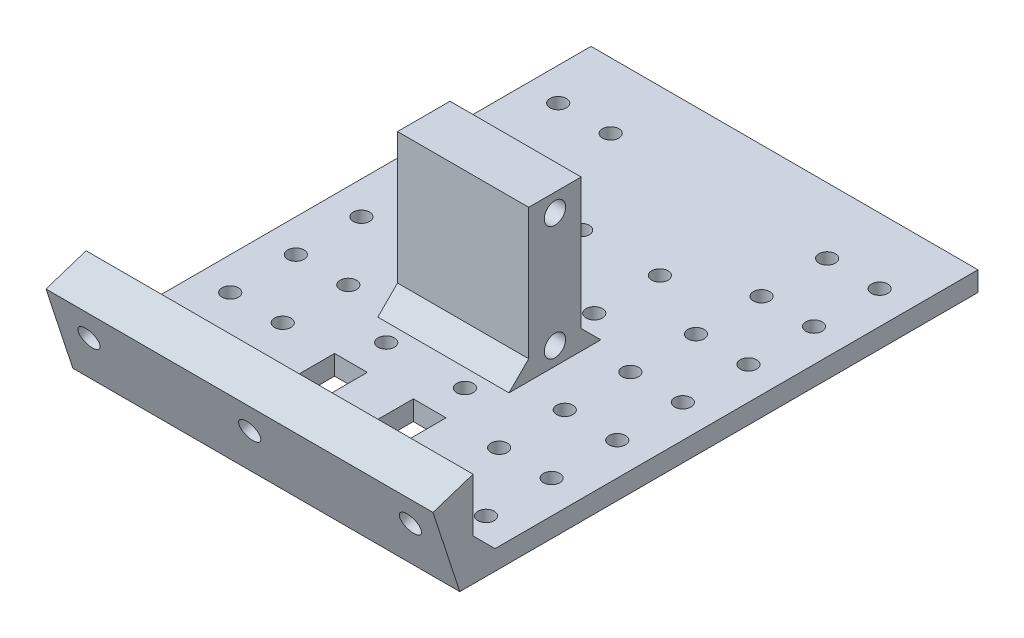
from build123d import *

# Parameters (mm, degrees)
SALIENTE_EXTRUIR1_DEPTH = 3
SKETCH1_W               = 20
SKETCH1_H               = 7
SKETCH1_H_2             = 8
SKETCH1_W_2             = 7
SKETCH1_H_3             = 38.5
BOSS_EXTRUDE1_DEPTH     = 23
CUT_EXTRUDE1_DEPTH      = 85.65548432
SKETCH3_R               = 1.625
CUT_EXTRUDE2_DEPTH      = 73.427902257
CORTAR_EXTRUIR1_DEPTH   = 10
CORTAR_EXTRUIR2_REACH   = 71.098
CROQUIS4_R              = 1.25
CORTAR_EXTRUIR3_DEPTH   = 3
BOSS_EXTRUDE2_DEPTH     = 20
SALIENTE_EXTRUIR2_DEPTH = 59
CORTAR_EXTRUIR4_REACH   = 91.44
CROQUIS7_R              = 1.625
CORTAR_EXTRUIR5_START   = -2.42548
CORTAR_EXTRUIR5_DEPTH   = 4
SALIENTE_EXTRUIR4_START = -20
SALIENTE_EXTRUIR4_DEPTH = 20
CROQUIS17_W             = 7
CROQUIS17_H             = 23
CORTAR_EXTRUIR11_DEPTH  = 73.427902257
CUT_EXTRUDE3_DEPTH      = 85.65548432
LOCAL_FILES2_R          = 1.625
CUT_EXTRUDE4_DEPTH      = 10
CUT_EXTRUDE5_START      = -2.42548
CUT_EXTRUDE5_DEPTH      = 4


with BuildPart() as part:
    # Croquis1 → Saliente-Extruir1 (new body)
    with BuildSketch(Plane(origin=(0, 0, 0), x_dir=(1, 0, 0), z_dir=(0, 1, 0))):
        Polygon((-29.5, 32.640625), (29.5, 32.640625), (29.5, -47.359375), (8.5, -47.359375), (8.5, -27.453125), (3.5, -27.453125), (3.5, -47.359375), (-3.5, -47.359375), (-3.5, -27.453125), (-8.5, -27.453125), (-8.5, -47.359375), (-29.5, -47.359375), align=None)
    extrude(amount=SALIENTE_EXTRUIR1_DEPTH)

    # Sketch1 → Boss-Extrude1 (add)
    with BuildSketch(Plane(origin=(0, 3, 0), x_dir=(1, 0, 0), z_dir=(0, 1, 0))):
        with Locations((0, 19.640625)):
            Rectangle(SKETCH1_W, SKETCH1_H)
        with Locations((0, -12.359375)):
            Rectangle(SKETCH1_W, SKETCH1_H_2)
        with Locations((0, -35.609375)):
            Rectangle(SKETCH1_W_2, SKETCH1_H_3)
    extrude(amount=BOSS_EXTRUDE1_DEPTH)

    # Sketch2 → Cut-Extrude1 (cut, through all)
    with BuildSketch(Plane(origin=(29.5, 0, 0), x_dir=(0, 0, -1), z_dir=(1, 0, 0))):
        Polygon((-54.859375, 26), (-46.359375, 0), (-47.359375, 0), (-47.359375, 3), (-54.859375, 3), align=None)
    extrude(amount=-CUT_EXTRUDE1_DEPTH, mode=Mode.SUBTRACT)

    # Sketch3 → Cut-Extrude2 (cut, through all)
    with BuildSketch(Plane.ZY.offset(10)):
        with Locations((12.359375, 5.75)):
            Circle(SKETCH3_R)
        with Locations((12.359375, 23.25)):
            Circle(SKETCH3_R)
    extrude(amount=-CUT_EXTRUDE2_DEPTH, mode=Mode.SUBTRACT)

    # Croquis2 → Cortar-Extruir1 (cut)
    with BuildSketch(Plane(origin=(0, 0, -23.140625), x_dir=(-1, 0, 0), z_dir=(0, 0, -1))):
        Polygon((-5, 6), (-5, 3), (5, 3), (5, 6), (5, 21), (-5, 21), align=None)
    extrude(amount=-CORTAR_EXTRUIR1_DEPTH, mode=Mode.SUBTRACT)

    # Croquis3 → Cortar-Extruir2 (cut, up to next)
    with BuildSketch(Plane.ZY.offset(3.5), mode=Mode.PRIVATE) as cortar_extruir2_sk1:
        Polygon((21.90625, 3), (36.90625, 3), (36.90625, 26), (21.90625, 26), (16.359375, 26), (16.359375, 3), align=None)
    cortar_extruir2_tool1 = extrude(cortar_extruir2_sk1.sketch, amount=-CORTAR_EXTRUIR2_REACH, mode=Mode.PRIVATE) & part.part
    add(cortar_extruir2_tool1.solids().sort_by_distance((-3.5, 14.5, 26.632812))[0], mode=Mode.SUBTRACT)

    # Croquis4 → Cortar-Extruir3 (cut)
    with BuildSketch(Plane.XZ):
        with Locations(Location((-24.5, -22.640625, 0), (0, 0, 270))):
            Circle(CROQUIS4_R)
        with Locations(Location((-16.5, -22.640625, 0), (0, 0, 270))):
            Circle(CROQUIS4_R)
        with Locations(Location((-16.5, -12.640625, 0), (0, 0, 270))):
            Circle(CROQUIS4_R)
        with Locations(Location((-16.5, -2.640625, 0), (0, 0, 270))):
            Circle(CROQUIS4_R)
        with Locations(Location((-16.5, 7.359375, 0), (0, 0, 270))):
            Circle(CROQUIS4_R)
        with Locations(Location((-16.5, 17.359375, 0), (0, 0, 270))):
            Circle(CROQUIS4_R)
        with Locations(Location((-16.5, 27.359375, 0), (0, 0, 270))):
            Circle(CROQUIS4_R)
        with Locations(Location((-16.5, 37.359375, 0), (0, 0, 270))):
            Circle(CROQUIS4_R)
        with Locations(Location((-24.5, -12.640625, 0), (0, 0, 270))):
            Circle(CROQUIS4_R)
        with Locations(Location((-24.5, -2.640625, 0), (0, 0, 270))):
            Circle(CROQUIS4_R)
        with Locations(Location((-24.5, 7.359375, 0), (0, 0, 270))):
            Circle(CROQUIS4_R)
        with Locations(Location((-24.5, 17.359375, 0), (0, 0, 270))):
            Circle(CROQUIS4_R)
        with Locations(Location((-24.5, 27.359375, 0), (0, 0, 270))):
            Circle(CROQUIS4_R)
        with Locations(Location((-24.5, 37.359375, 0), (0, 0, 270))):
            Circle(CROQUIS4_R)
        with Locations(Location((16.5, 37.359375, 0), (0, 0, 270))):
            Circle(CROQUIS4_R)
        with Locations(Location((24.5, 37.359375, 0), (0, 0, 270))):
            Circle(CROQUIS4_R)
        with Locations(Location((16.5, 27.359375, 0), (0, 0, 270))):
            Circle(CROQUIS4_R)
        with Locations(Location((24.5, 27.359375, 0), (0, 0, 270))):
            Circle(CROQUIS4_R)
        with Locations(Location((16.5, 17.359375, 0), (0, 0, 270))):
            Circle(CROQUIS4_R)
        with Locations(Location((24.5, 17.359375, 0), (0, 0, 270))):
            Circle(CROQUIS4_R)
        with Locations(Location((24.5, 7.359375, 0), (0, 0, 270))):
            Circle(CROQUIS4_R)
        with Locations(Location((16.5, 7.359375, 0), (0, 0, 270))):
            Circle(CROQUIS4_R)
        with Locations(Location((16.5, -2.640625, 0), (0, 0, 270))):
            Circle(CROQUIS4_R)
        with Locations(Location((24.5, -2.640625, 0), (0, 0, 270))):
            Circle(CROQUIS4_R)
        with Locations(Location((24.5, -12.640625, 0), (0, 0, 270))):
            Circle(CROQUIS4_R)
        with Locations(Location((16.5, -12.640625, 0), (0, 0, 270))):
            Circle(CROQUIS4_R)
        with Locations(Location((16.5, -22.640625, 0), (0, 0, 270))):
            Circle(CROQUIS4_R)
        with Locations(Location((24.5, -22.640625, 0), (0, 0, 270))):
            Circle(CROQUIS4_R)
        with Locations(Location((6, 22.084531493, 0), (0, 0, 270))):
            Circle(CROQUIS4_R)
        with Locations(Location((-6, 22.084531493, 0), (0, 0, 270))):
            Circle(CROQUIS4_R)
        with Locations(Location((6, 2.359375, 0), (0, 0, 270))):
            Circle(CROQUIS4_R)
        with Locations(Location((-6, 2.359375, 0), (0, 0, 270))):
            Circle(CROQUIS4_R)
        with Locations(Location((-6, -7.640625, 0), (0, 0, 270))):
            Circle(CROQUIS4_R)
        with Locations(Location((6, -7.640625, 0), (0, 0, 270))):
            Circle(CROQUIS4_R)
    extrude(amount=-CORTAR_EXTRUIR3_DEPTH, mode=Mode.SUBTRACT)

    # Sketch5 → Boss-Extrude2 (add)
    with BuildSketch(Plane(origin=(-8.5, 0, 0), x_dir=(0, 0, -1), z_dir=(1, 0, 0))):
        Polygon((-36.90625, 3), (-36.90625, 0), (-46.359375, 0), (-47.340144231, 3), align=None)
    extrude(amount=BOSS_EXTRUDE2_DEPTH)

    # Croquis6 → Saliente-Extruir2 (add)
    with BuildSketch(Plane.ZY.offset(29.5)):
        Polygon((44.340144231, 3), (47.340144231, 3), (50.447532794, 12.504953252), (44.340144231, 14.501599513), (44.340144231, 6.347956044), align=None)
        Polygon((40.990144231, 3), (44.340144231, 3), (44.340144231, 6.347956044), align=None)
    extrude(amount=-SALIENTE_EXTRUIR2_DEPTH)

    # Cortar-Extruir4: up to this plane
    cortar_extruir4_end = Plane(origin=(29.5, 0, 44.340144231), z_dir=(0, 0, -1))
    # Croquis7 → Cortar-Extruir4 (cut, up to the surface)
    with BuildSketch(Plane(origin=(0, -13.692511694, 41.882976946), x_dir=(1, 0, 0), z_dir=(0, -0.31073885630742226, 0.9504953251756452)), mode=Mode.PRIVATE) as cortar_extruir4_sk1:
        with Locations(Location((-24.5, 22.561908251, 0), (0, 0, 270))):
            Circle(CROQUIS7_R)
    cortar_extruir4_tool1 = split(extrude(cortar_extruir4_sk1.sketch, amount=-CORTAR_EXTRUIR4_REACH, mode=Mode.PRIVATE), bisect_by=cortar_extruir4_end, keep=Keep.BOTH, mode=Mode.PRIVATE)
    add(cortar_extruir4_tool1.solids().sort_by_distance((-24.5, 7.752477, 48.893839))[0], mode=Mode.SUBTRACT)

    # Croquis8 → Cortar-Extruir5 (cut)
    with BuildSketch(Plane(origin=(0, -13.692511694, 41.882976946), x_dir=(1, 0, 0), z_dir=(0, -0.31073885630742226, 0.9504953251756452)).offset(CORTAR_EXTRUIR5_START)):
        Polygon((-22.91228676, 19.811908251), (-21.324573519, 22.561908251), (-22.91228676, 25.311908251), (-26.08771324, 25.311908251), (-27.675426481, 22.561908251), (-26.08771324, 19.811908251), align=None)
    extrude(amount=-CORTAR_EXTRUIR5_DEPTH, mode=Mode.SUBTRACT)

    # Croquis16 → Saliente-Extruir4 (add)
    with BuildSketch(Plane(origin=(10, 0, 0), x_dir=(0, 0, -1), z_dir=(1, 0, 0)).offset(SALIENTE_EXTRUIR4_START)):
        Polygon((-8.359375, 6), (-5.359375, 3), (-8.359375, 3), align=None)
        Polygon((-19.359375, 3), (-16.359375, 3), (-16.359375, 6), align=None)
    extrude(amount=SALIENTE_EXTRUIR4_DEPTH)

    # Croquis17 → Cortar-Extruir11 (cut, through all)
    with BuildSketch(Plane.ZY.offset(10)):
        with Locations((-19.640625, 14.5)):
            Rectangle(CROQUIS17_W, CROQUIS17_H)
    extrude(amount=-CORTAR_EXTRUIR11_DEPTH, mode=Mode.SUBTRACT)

    # Local Files1 → Cut-Extrude3 (cut, through all)
    with BuildSketch(Plane.ZY.offset(29.5)):
        Polygon((36.90625, 3), (40.990144231, 3), (44.340144231, 6.347956044), (44.340144231, 14.501599513), (50.447532794, 12.504953252), (54.859375, 26), (36.90625, 26), align=None)
    extrude(amount=-CUT_EXTRUDE3_DEPTH, mode=Mode.SUBTRACT)

    # Local Files2 → Cut-Extrude4 (cut)
    with BuildSketch(Plane(origin=(0, -13.692511694, 41.882976946), x_dir=(1, 0, 0), z_dir=(0, -0.31073885630742226, 0.9504953251756452))):
        with Locations(Location((0, 22.561908251, 0), (0, 0, 270))):
            Circle(LOCAL_FILES2_R)
        with Locations(Location((-24.5, 22.561908251, 0), (0, 0, 270))):
            Circle(LOCAL_FILES2_R)
        with Locations(Location((24.5, 22.561908251, 0), (0, 0, 270))):
            Circle(LOCAL_FILES2_R)
    extrude(amount=-CUT_EXTRUDE4_DEPTH, mode=Mode.SUBTRACT)

    # Local Files4 → Cut-Extrude5 (cut)
    with BuildSketch(Plane(origin=(0, -13.692511694, 41.882976946), x_dir=(1, 0, 0), z_dir=(0, -0.31073885630742226, 0.9504953251756452)).offset(CUT_EXTRUDE5_START)):
        Polygon((1.58771324, 19.811908251), (3.175426481, 22.561908251), (1.58771324, 25.311908251), (-1.58771324, 25.311908251), (-3.175426481, 22.561908251), (-1.58771324, 19.811908251), align=None)
        Polygon((26.08771324, 19.811908251), (27.675426481, 22.561908251), (26.08771324, 25.311908251), (22.91228676, 25.311908251), (21.324573519, 22.561908251), (22.91228676, 19.811908251), align=None)
    extrude(amount=-CUT_EXTRUDE5_DEPTH, mode=Mode.SUBTRACT)


solid = part.part
